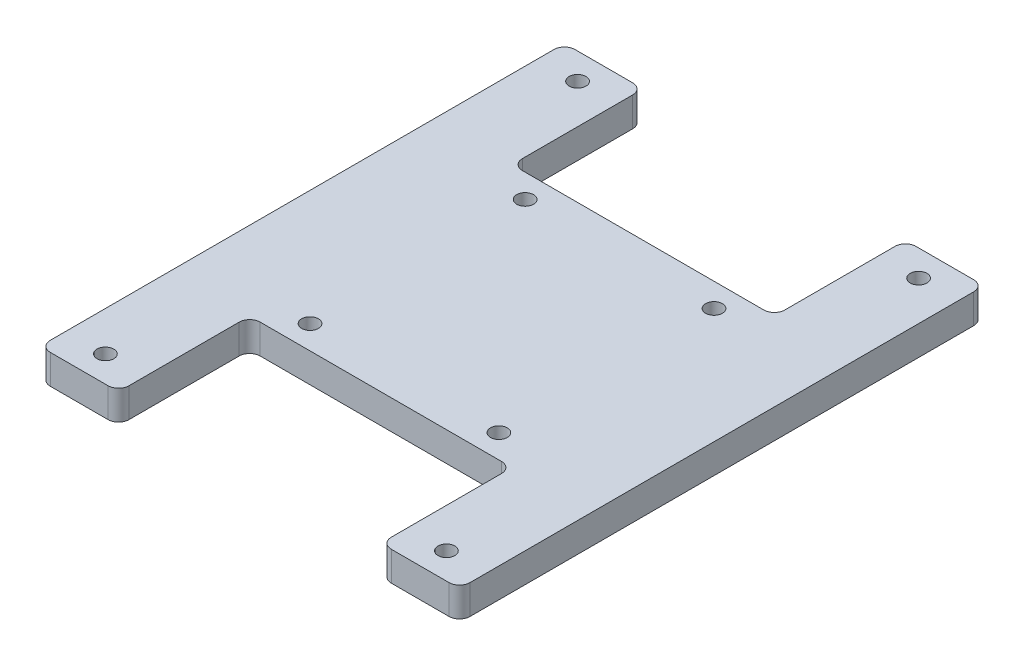
from build123d import *

# Parameters (mm, degrees)
SKETCH_1_R          = 1.6
EXTRUDE_1_DEPTH     = 5.6
SKETCH_2_R          = 1.6
CUT_EXTRUDE_1_DEPTH = 65.275656356
FILLET_1_R          = 2


with BuildPart() as part:
    # ｽｹｯﾁ1 → ﾎﾞｽ - 押し出し1 (new body)
    with BuildSketch(Plane(origin=(0, 0, 0), x_dir=(1, 0, 0), z_dir=(0, 1, 0))):
        Polygon((-25, 50), (-40, 50), (-40, -50), (-25, -50), (-25, -25), (25, -25), (25, -50), (40, -50), (40, 50), (25, 50), (25, 25), (-25, 25), align=None)
        with Locations(Location((-32.5, -45, 0), (0, 0, 270))):
            Circle(SKETCH_1_R, mode=Mode.SUBTRACT)
        with Locations(Location((32.5, -45, 0), (0, 0, 270))):
            Circle(SKETCH_1_R, mode=Mode.SUBTRACT)
        with Locations(Location((-32.5, 45, 0), (0, 0, 270))):
            Circle(SKETCH_1_R, mode=Mode.SUBTRACT)
        with Locations(Location((32.5, 45, 0), (0, 0, 270))):
            Circle(SKETCH_1_R, mode=Mode.SUBTRACT)
    extrude(amount=EXTRUDE_1_DEPTH)

    # ｽｹｯﾁ2 → ｶｯﾄ - 押し出し1 (cut, through all)
    with BuildSketch(Plane(origin=(0, 5.6, 0), x_dir=(1, 0, 0), z_dir=(0, 1, 0))):
        with Locations(Location((18, 20.5, 0), (0, 0, 270))):
            Circle(SKETCH_2_R)
        with Locations(Location((18, -20.5, 0), (0, 0, 90))):
            Circle(SKETCH_2_R)
        with Locations(Location((-18, -20.5, 0), (0, 0, 270))):
            Circle(SKETCH_2_R)
        with Locations(Location((-18, 20.5, 0), (0, 0, 90))):
            Circle(SKETCH_2_R)
    extrude(amount=-CUT_EXTRUDE_1_DEPTH, mode=Mode.SUBTRACT)

    # ﾌｨﾚｯﾄ1
    fillet_1_edges = [part.edges().sort_by_distance(p)[0] for p in [
        (-25, 2.8, 50),
        (-40, 2.8, 50),
        (-40, 2.8, -50),
        (-25, 2.8, -50),
        (-25, 2.8, -25),
        (25, 2.8, -25),
        (25, 2.8, -50),
        (40, 2.8, -50),
        (40, 2.8, 50),
        (25, 2.8, 50),
        (25, 2.8, 25),
        (-25, 2.8, 25),
    ]]
    fillet(fillet_1_edges, radius=FILLET_1_R)


solid = part.part
